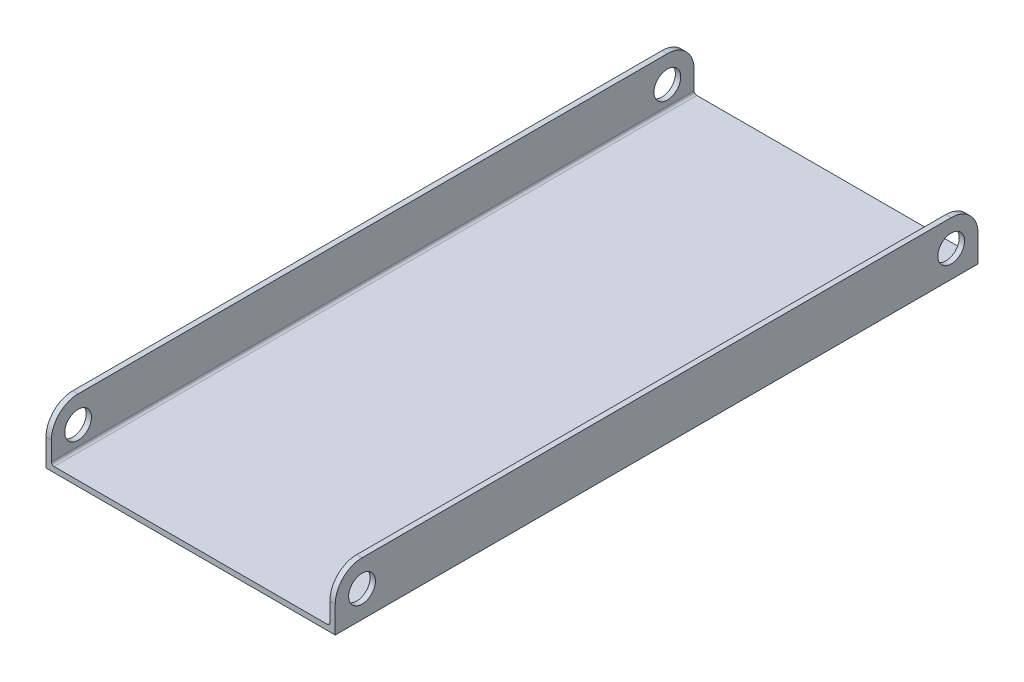
from build123d import *

# Parameters (mm, degrees)
SKETCH1_W           = 68.58
SKETCH1_H           = 152.4
BOSS_EXTRUDE1_DEPTH = 12.7
SKETCH2_W           = 66.04
SKETCH2_H           = 11.43
CUT_EXTRUDE1_DEPTH  = 168.601510733
FILLET1_R           = 0.635
FILLET2_R           = 6.35
SKETCH3_R           = 3.175
CUT_EXTRUDE2_DEPTH  = 168.601510733


with BuildPart() as part:
    # Sketch1 → Boss-Extrude1 (new body)
    with BuildSketch(Plane(origin=(0, 0, 0), x_dir=(1, 0, 0), z_dir=(0, 1, 0))):
        with Locations((34.29, 76.2)):
            Rectangle(SKETCH1_W, SKETCH1_H)
    extrude(amount=BOSS_EXTRUDE1_DEPTH)

    # Sketch2 → Cut-Extrude1 (cut, through all)
    with BuildSketch(Plane.XY):
        with Locations((34.29, 6.985)):
            Rectangle(SKETCH2_W, SKETCH2_H)
    extrude(amount=-CUT_EXTRUDE1_DEPTH, mode=Mode.SUBTRACT)

    # Fillet1
    fillet1_edges = [part.edges().sort_by_distance(p)[0] for p in [
        (1.27, 1.27, -76.2),
        (67.31, 1.27, -76.2),
    ]]
    fillet(fillet1_edges, radius=FILLET1_R)

    # Fillet2
    fillet2_edges = [part.edges().sort_by_distance(p)[0] for p in [
        (67.945, 12.7, 0),
        (0.635, 12.7, -152.4),
        (67.945, 12.7, -152.4),
        (0.635, 12.7, 0),
    ]]
    fillet(fillet2_edges, radius=FILLET2_R)

    # Sketch3 → Cut-Extrude2 (cut, through all)
    with BuildSketch(Plane(origin=(68.58, 0, 0), x_dir=(0, 0, -1), z_dir=(1, 0, 0))):
        with Locations((6.35, 6.35)):
            Circle(SKETCH3_R)
        with Locations((146.05, 6.35)):
            Circle(SKETCH3_R)
    extrude(amount=-CUT_EXTRUDE2_DEPTH, mode=Mode.SUBTRACT)


solid = part.part
